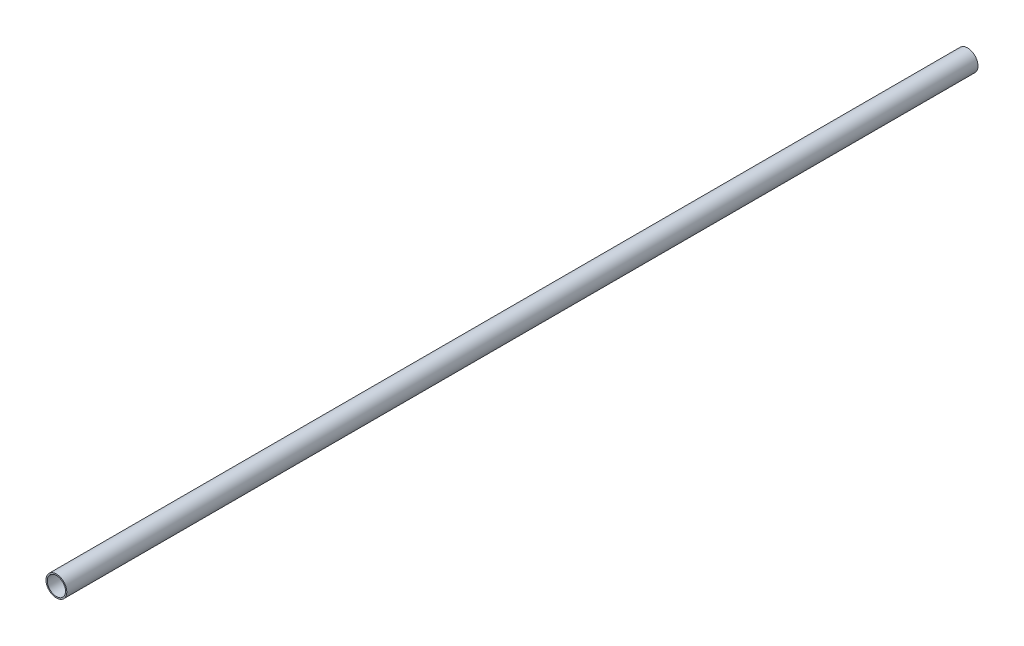
from build123d import *

# Parameters (mm, degrees)
SKETCH_1_R      = 8
SKETCH_1_R_2    = 7
EXTRUDE_1_DEPTH = 350


with BuildPart() as part:
    # Эскиз1 → Бобышка-Вытянуть1 (new, symmetric)
    with BuildSketch(Plane.XY):
        Circle(SKETCH_1_R)
        Circle(SKETCH_1_R_2, mode=Mode.SUBTRACT)
    extrude(amount=EXTRUDE_1_DEPTH, both=True)


solid = part.part
